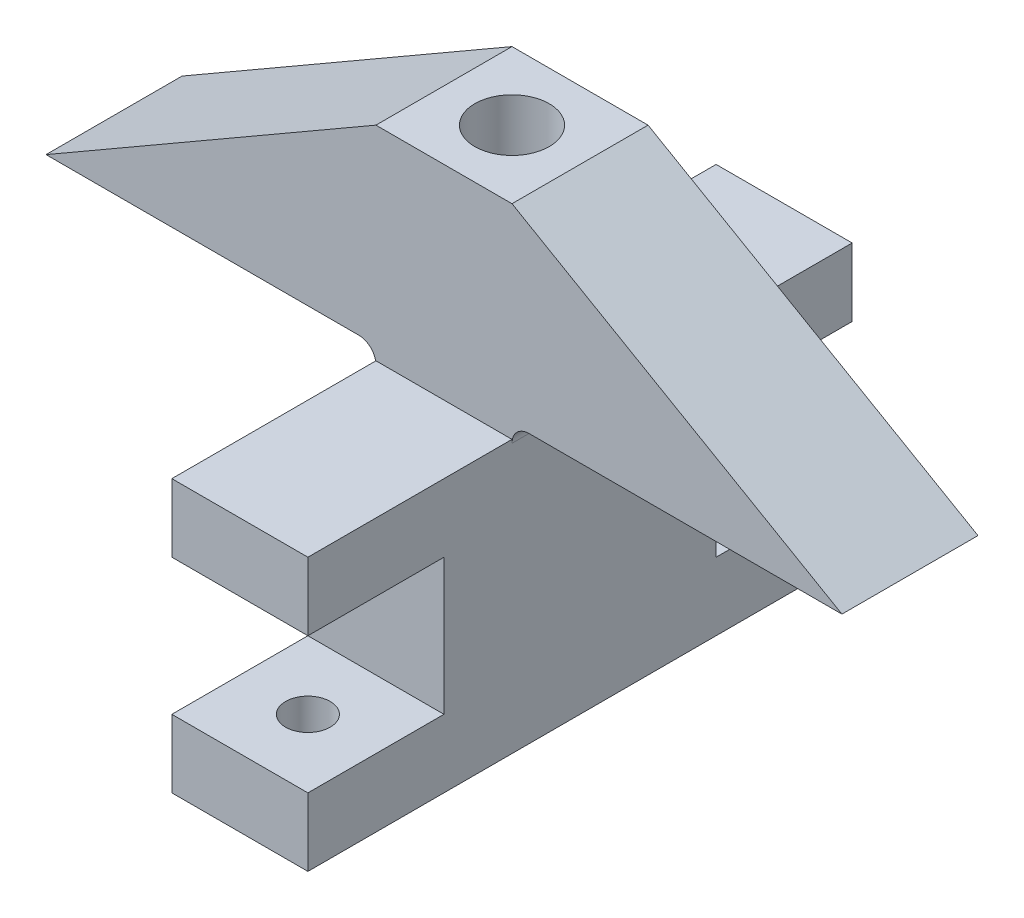
from build123d import *

# Parameters (mm, degrees)
BOSS_EXTRUDE1_DEPTH        = 25.4
SKETCH2_W                  = 25.4
SKETCH2_H                  = 12.7
BOSS_EXTRUDE2_DEPTH        = 38.1
SKETCH3_W                  = 25.4
SKETCH3_H                  = 12.7
BOSS_EXTRUDE3_DEPTH        = 38.1
F_0_328IN_DOWEL_HOLE1_D    = 8.3312
F_0_55IN_DOWEL_HOLE2_D     = 13.8938
F_0_55IN_DOWEL_HOLE2_DEPTH = 35.052
F_0_55IN_DOWEL_HOLE2_TIP   = 4.174118634
FILLET1_R                  = 3.175
SKETCH8_W                  = 25.4
SKETCH8_H                  = 25.4
BOSS_EXTRUDE4_DEPTH        = 12.7
BOSS_EXTRUDE5_DEPTH        = 38.1
SKETCH9_W                  = 25.4
SKETCH9_H                  = 25.4
BOSS_EXTRUDE6_DEPTH        = 12.7
BOSS_EXTRUDE7_DEPTH        = 38.1


with BuildPart() as part:
    # Sketch1 → Boss-Extrude1 (new body)
    with BuildSketch(Plane.XY):
        Polygon((0, 0), (0, 53.34), (-61.591726717, 53.34), (0, 88.9), (25.4, 88.9), (86.991726717, 53.34), (25.4, 53.34), (25.4, 0), align=None)
    extrude(amount=BOSS_EXTRUDE1_DEPTH)

    # Sketch2 → Boss-Extrude2 (add)
    with BuildSketch(Plane.XY.offset(25.4)):
        with Locations((12.7, 6.35)):
            Rectangle(SKETCH2_W, SKETCH2_H)
    extrude(amount=BOSS_EXTRUDE2_DEPTH)

    # Sketch3 → Boss-Extrude3 (add)
    with BuildSketch(Plane(origin=(0, 0, 0), x_dir=(-1, 0, 0), z_dir=(0, 0, -1))):
        with Locations((-12.7, 6.35)):
            Rectangle(SKETCH3_W, SKETCH3_H)
    extrude(amount=BOSS_EXTRUDE3_DEPTH)

    # Ø0.328in Dowel Hole1 (through all)
    with Locations(Plane(origin=(0, 12.7, 0), x_dir=(1, 0, 0), z_dir=(0, 1, 0))):
        with Locations((12.7, 25.4), (12.7, -50.8)):
            Hole(F_0_328IN_DOWEL_HOLE1_D / 2)

    # Ø0.55in Dowel Hole2
    with Locations(Plane(origin=(0, 88.9, 0), x_dir=(1, 0, 0), z_dir=(0, 1, 0))):
        with Locations((12.7, -12.7)):
            Hole(F_0_55IN_DOWEL_HOLE2_D / 2, depth=F_0_55IN_DOWEL_HOLE2_DEPTH)
            with Locations((0, 0, -(F_0_55IN_DOWEL_HOLE2_DEPTH + F_0_55IN_DOWEL_HOLE2_TIP / 2))):  # 118° drill point
                Cone(0, F_0_55IN_DOWEL_HOLE2_D / 2, F_0_55IN_DOWEL_HOLE2_TIP, mode=Mode.SUBTRACT)

    # Fillet1
    fillet1_edges = [part.edges().sort_by_distance(p)[0] for p in [
        (25.4, 53.34, 12.7),
        (0, 53.34, 12.7),
    ]]
    fillet(fillet1_edges, radius=FILLET1_R)

    # Sketch8 → Boss-Extrude4 (add)
    with BuildSketch(Plane.XY.offset(25.4)):
        with Locations((12.7, 25.4)):
            Rectangle(SKETCH8_W, SKETCH8_H)
    extrude(amount=BOSS_EXTRUDE4_DEPTH)

    # Sketch8<3> → Boss-Extrude5 (add)
    with BuildSketch(Plane.XY.offset(25.4)):
        Polygon((0, 50.165), (0, 38.1), (25.4, 38.1), (25.4, 50.8), (0, 50.8), align=None)
    extrude(amount=BOSS_EXTRUDE5_DEPTH)

    # Sketch9 → Boss-Extrude6 (add)
    with BuildSketch(Plane(origin=(0, 0, 0), x_dir=(-1, 0, 0), z_dir=(0, 0, -1))):
        with Locations((-12.7, 25.4)):
            Rectangle(SKETCH9_W, SKETCH9_H)
    extrude(amount=BOSS_EXTRUDE6_DEPTH)

    # Sketch9<3> → Boss-Extrude7 (add)
    with BuildSketch(Plane(origin=(0, 0, 0), x_dir=(-1, 0, 0), z_dir=(0, 0, -1))):
        Polygon((-25.4, 50.165), (-25.4, 38.1), (0, 38.1), (0, 50.165), (0, 50.8), (-25.4, 50.8), align=None)
    extrude(amount=BOSS_EXTRUDE7_DEPTH)


solid = part.part
